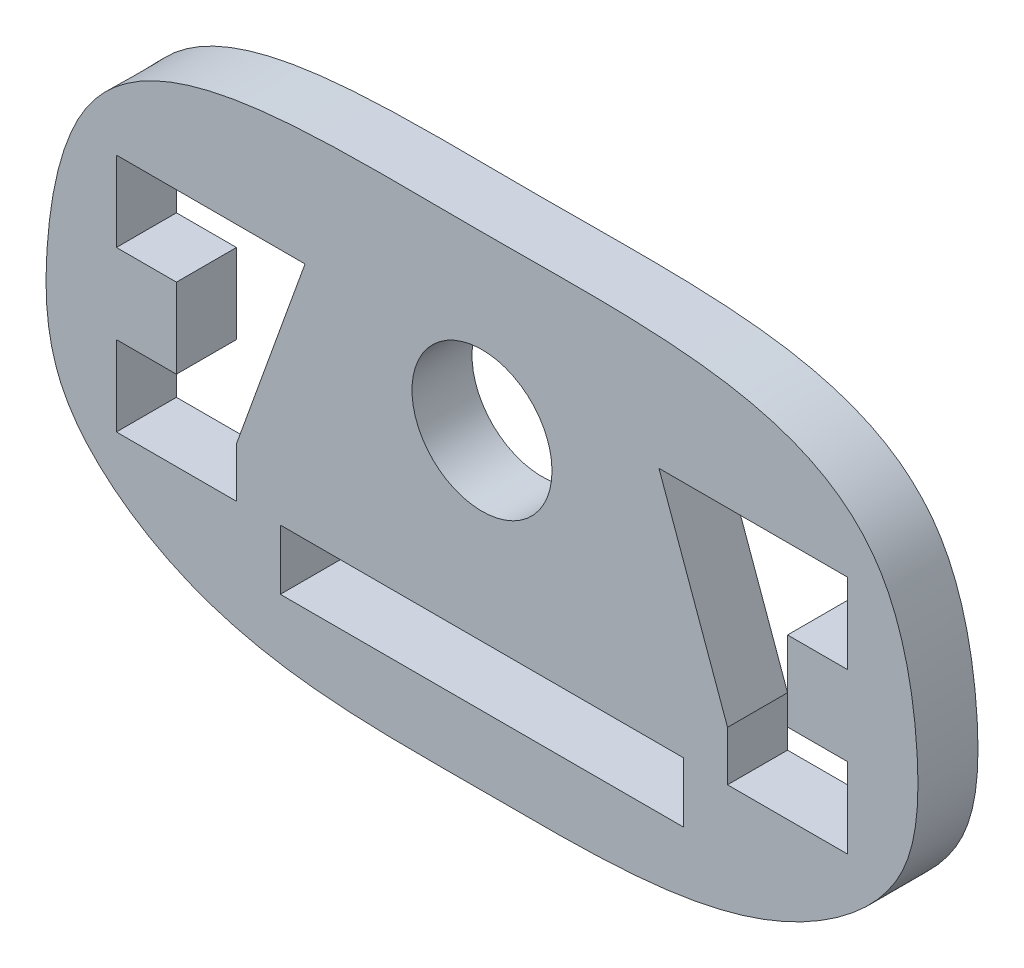
from build123d import *

# Parameters (mm, degrees)
SKETCH1_R           = 3.5
SKETCH1_W           = 20.16
SKETCH1_H           = 3
BOSS_EXTRUDE1_DEPTH = 3


with BuildPart() as part:
    # Sketch1 → Boss-Extrude1 (new body)
    with BuildSketch(Plane.XY):
        with BuildLine():
            add(Edge.make_bspline(
                [(0, 8.587), (-8.295312862, 8.587), (-19.533608005, 9.374483524), (-21.995774121, -2.528835604), (-21.673613051, -9.045291624), (-13.850048986, -15.884203414), (0, -15.368261488), (13.850048986, -15.884203414), (21.673613051, -9.045291624), (21.995774121, -2.528835604), (19.533608005, 9.374483524), (8.295312862, 8.587), (0, 8.587)],
                knots=[0, 0, 0, 0, 0.181616286, 0.246049481, 0.295476387, 0.349472823, 0.5, 0.650527177, 0.704523613, 0.753950519, 0.818383714, 1, 1, 1, 1], degree=3))
        make_face()
        Circle(SKETCH1_R, mode=Mode.SUBTRACT)
        with Locations((0, -10.633)):
            Rectangle(SKETCH1_W, SKETCH1_H, mode=Mode.SUBTRACT)
        Polygon((-8.846, 2.785), (-18.273, 2.785), (-18.273, -1.215), (-15.273, -1.215), (-15.273, -5.202), (-18.273, -5.202), (-18.273, -9.202), (-12.273, -9.202), (-12.273, -6.715), align=None, mode=Mode.SUBTRACT)
        Polygon((12.273, -6.715), (8.846, 2.785), (18.273, 2.785), (18.273, -1.215), (15.273, -1.215), (15.273, -5.202), (18.273, -5.202), (18.273, -9.202), (12.273, -9.202), align=None, mode=Mode.SUBTRACT)
    extrude(amount=-BOSS_EXTRUDE1_DEPTH)


solid = part.part
